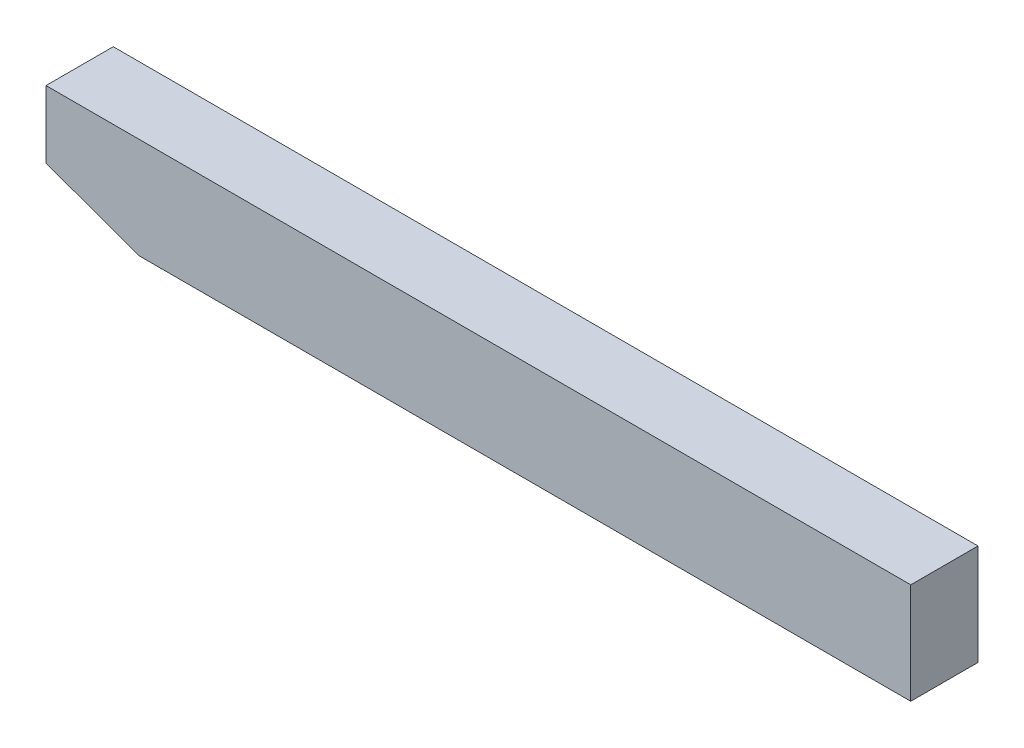
from build123d import *

# Parameters (mm, degrees)
SKETCH1_W               = 25.4
SKETCH1_H               = 25.4
BOSS_EXTRUDE1_DEPTH     = 326.569392859
CUT_EXTRUDE1_DEPTH      = 328.80179736
CUT_EXTRUDE1_DEPTH_BACK = 328.80179736
SKETCH3_W               = 326.569392859
SKETCH3_H               = 12.7
BOSS_EXTRUDE2_DEPTH     = 25.4


with BuildPart() as part:
    # Sketch1 → Boss-Extrude1 (new body)
    with BuildSketch(Plane(origin=(0, 0, 0), x_dir=(0, 0, -1), z_dir=(1, 0, 0))):
        Rectangle(SKETCH1_W, SKETCH1_H)
    extrude(amount=BOSS_EXTRUDE1_DEPTH)

    # Sketch2 → Cut-Extrude1 (cut, two sides: drawn at the far end of the back side and taken through both)
    with BuildSketch(Plane.XY.offset(12.7).offset(-CUT_EXTRUDE1_DEPTH_BACK)):
        Polygon((0, -12.7), (0, 0), (35.294934027, -12.7), align=None)
    extrude(amount=CUT_EXTRUDE1_DEPTH + CUT_EXTRUDE1_DEPTH_BACK, mode=Mode.SUBTRACT)

    # Sketch3 → Boss-Extrude2 (add)
    with BuildSketch(Plane.XY.offset(12.7)):
        with Locations((163.28469643, 19.05)):
            Rectangle(SKETCH3_W, SKETCH3_H)
    extrude(amount=-BOSS_EXTRUDE2_DEPTH)


solid = part.part
